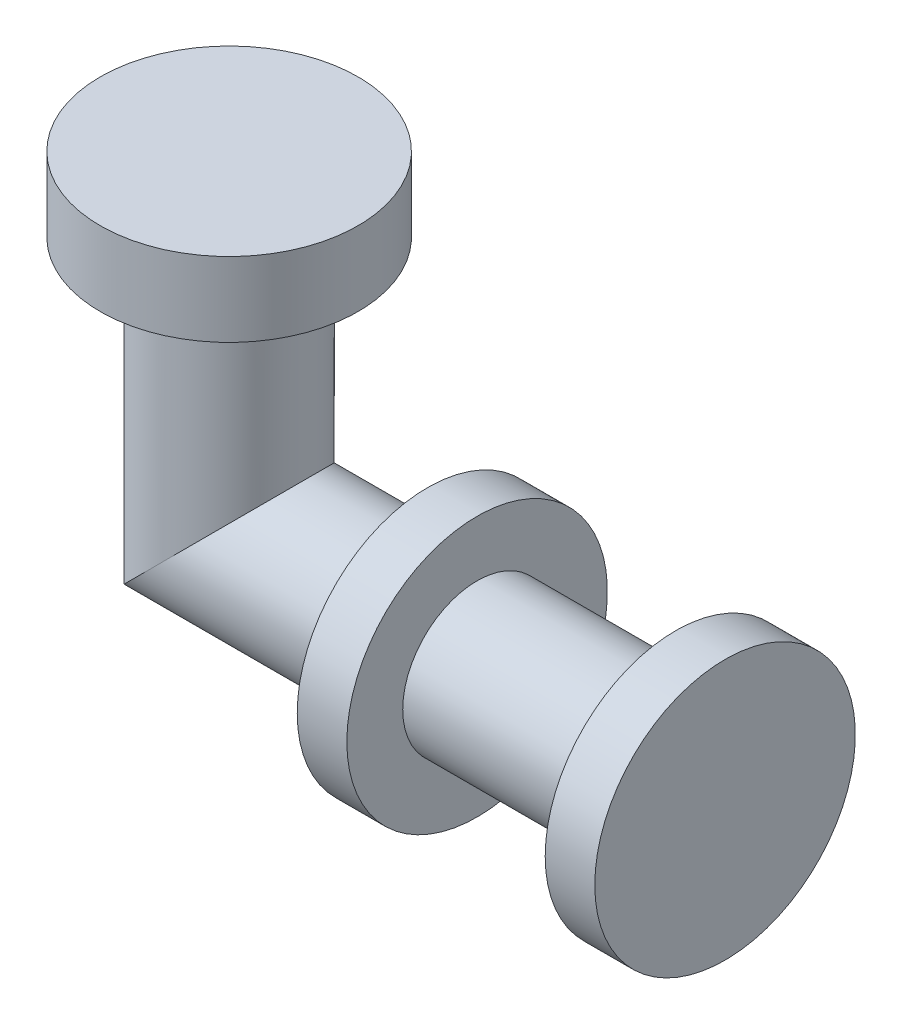
from build123d import *

# Parameters (mm, degrees)
SKETCH2_R           = 19.05
SKETCH3_R           = 33.02
BOSS_EXTRUDE1_DEPTH = 19.05
SKETCH4_W           = 12.7
SKETCH4_H           = 14.313474639


with BuildPart() as part:
    # Sweep1: sweep along a path in Sketch1
    with BuildLine(Plane.XY) as sweep1_path:
        Line((0, 82.55), (0, 0))
        Line((0, 0), (127, 0))
    # Sketch2 → Sweep1 (sweep)
    with BuildSketch(Plane(origin=(127, 0, 0), x_dir=(0, 0, -1), z_dir=(1, 0, 0))):
        Circle(SKETCH2_R)
    sweep(path=sweep1_path.line, transition=Transition.RIGHT)

    # Sketch3 → Boss-Extrude1 (add)
    with BuildSketch(Plane(origin=(0, 82.55, 0), x_dir=(1, 0, 0), z_dir=(0, 1, 0))):
        with Locations(Location((0, 0, 0), (0, 0, 180))):
            Circle(SKETCH3_R)
    extrude(amount=-BOSS_EXTRUDE1_DEPTH)

    # Sketch4 → Revolve1 (revolve)
    with BuildSketch(Plane.XY, mode=Mode.PRIVATE) as revolve1_sk:
        with Locations((120.65, 26.20673732)):
            Rectangle(SKETCH4_W, SKETCH4_H)
        with Locations((57.15, 26.20673732)):
            Rectangle(SKETCH4_W, SKETCH4_H)
    revolve(revolve1_sk.sketch.rotate(Axis((0, 0, 0), (1, 0, 0)), 90), axis=Axis((0, 0, 0), (1, 0, 0)))


solid = part.part
